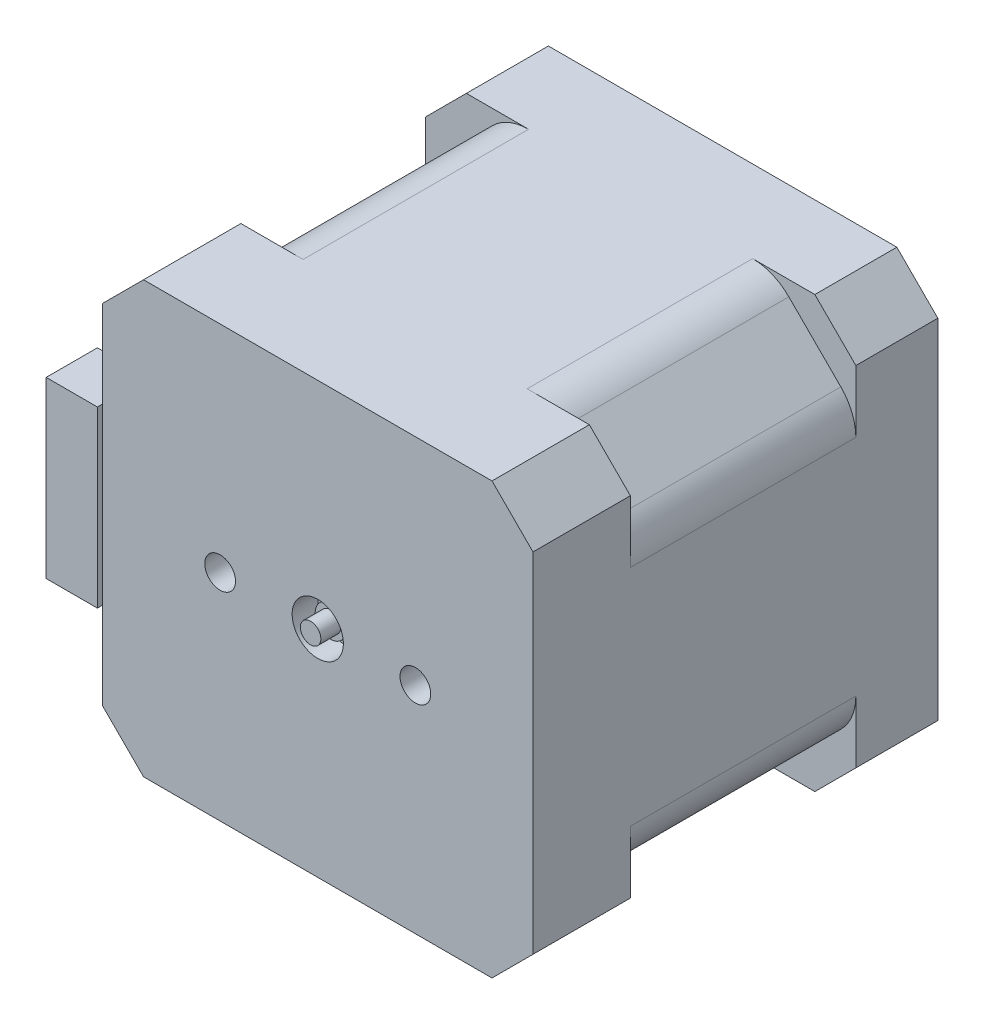
from build123d import *

# Parameters (mm, degrees)
EXTRUDE_1_DEPTH          = 8
CUT_EXTRUDE_1_REACH      = 61.933
SKETCH_2_R               = 1.5
EXTRUDE_2_DEPTH          = 22
CUT_EXTRUDE_2_DEPTH      = 22
EXTRUDE_3_DEPTH          = 9.5
SKETCH_8_R               = 1.5
CUT_EXTRUDE_3_DEPTH      = 5
SKETCH_10_R              = 2.5
CUT_EXTRUDE_4_DEPTH      = 2.5
SKETCH_11_R              = 1.5
EXTRUDE_4_DEPTH          = 1.25
SKETCH_12_R              = 1
EXTRUDE_5_DEPTH          = 1.95
FILLET_3_R               = 5
SKETCH_13_R              = 12.5
EXTRUDE_6_DEPTH          = 2
SKETCH_14_R              = 2.5
EXTRUDE_7_DEPTH          = 11
CUT_EXTRUDE_5_DEPTH      = 80.738572849
CUT_EXTRUDE_5_DEPTH_BACK = 9.8
EXTRUDE_6_2_DEPTH        = 5
EXTRUDE_8_REACH          = 61.412
SKETCH_18_W              = 1
SKETCH_18_H              = 1


with BuildPart() as part:
    # 草图1 → 凸台-拉伸1 (new body)
    with BuildSketch(Plane.XY):
        Polygon((0, 38), (4, 42), (38, 42), (42, 38), (42, 4), (38, 0), (4, 0), (0, 4), align=None)
    extrude(amount=-EXTRUDE_1_DEPTH)

    # 草图2 → 切除-拉伸1 (cut, up to next)
    with BuildSketch(Plane.XY, mode=Mode.PRIVATE) as cut_extrude_1_sk1:
        with Locations((5.5, 36.5)):
            Circle(SKETCH_2_R)
    cut_extrude_1_tool1 = extrude(cut_extrude_1_sk1.sketch, amount=-CUT_EXTRUDE_1_REACH, mode=Mode.PRIVATE) & part.part
    # 草图2 → 切除-拉伸1 (cut, up to next)
    with BuildSketch(Plane.XY, mode=Mode.PRIVATE) as cut_extrude_1_sk2:
        with Locations(Location((5.5, 5.5, 0), (0, 0, 180))):
            Circle(SKETCH_2_R)
    cut_extrude_1_tool2 = extrude(cut_extrude_1_sk2.sketch, amount=-CUT_EXTRUDE_1_REACH, mode=Mode.PRIVATE) & part.part
    # 草图2 → 切除-拉伸1 (cut, up to next)
    with BuildSketch(Plane.XY, mode=Mode.PRIVATE) as cut_extrude_1_sk3:
        with Locations(Location((36.5, 36.5, 0), (0, 0, 180))):
            Circle(SKETCH_2_R)
    cut_extrude_1_tool3 = extrude(cut_extrude_1_sk3.sketch, amount=-CUT_EXTRUDE_1_REACH, mode=Mode.PRIVATE) & part.part
    # 草图2 → 切除-拉伸1 (cut, up to next)
    with BuildSketch(Plane.XY, mode=Mode.PRIVATE) as cut_extrude_1_sk4:
        with Locations((36.5, 5.5)):
            Circle(SKETCH_2_R)
    cut_extrude_1_tool4 = extrude(cut_extrude_1_sk4.sketch, amount=-CUT_EXTRUDE_1_REACH, mode=Mode.PRIVATE) & part.part
    add(cut_extrude_1_tool1.solids().sort_by_distance((5.5, 36.5, 0))[0], mode=Mode.SUBTRACT)
    add(cut_extrude_1_tool2.solids().sort_by_distance((5.5, 5.5, 0))[0], mode=Mode.SUBTRACT)
    add(cut_extrude_1_tool3.solids().sort_by_distance((36.5, 36.5, 0))[0], mode=Mode.SUBTRACT)
    add(cut_extrude_1_tool4.solids().sort_by_distance((36.5, 5.5, 0))[0], mode=Mode.SUBTRACT)

    # 草图5 → 凸台-拉伸2 (add)
    with BuildSketch(Plane.XY):
        Polygon((0, 4), (4, 0), (38, 0), (42, 4), (42, 38), (38, 42), (4, 42), (0, 38), align=None)
    extrude(amount=EXTRUDE_2_DEPTH)

    # 草图6 → 切除-拉伸2 (cut)
    with BuildSketch(Plane.XY.offset(22)):
        Polygon((8, 0), (0, 8), (0, 4), (4, 0), align=None)
        Polygon((42, 8), (34, 0), (38, 0), (42, 4), align=None)
        Polygon((38, 42), (34, 42), (42, 34), (42, 38), align=None)
        Polygon((0, 38), (0, 34), (8, 42), (4, 42), align=None)
    extrude(amount=-CUT_EXTRUDE_2_DEPTH, mode=Mode.SUBTRACT)

    # 草图7 → 凸台-拉伸3 (add)
    with BuildSketch(Plane.XY.offset(22)):
        Polygon((0, 38), (0, 4), (4, 0), (38, 0), (42, 4), (42, 38), (38, 42), (4, 42), align=None)
    extrude(amount=EXTRUDE_3_DEPTH)

    # 草图8 → 切除-拉伸3 (cut)
    with BuildSketch(Plane.XY.offset(31.5)):
        with Locations((11.475, 21)):
            Circle(SKETCH_8_R)
        with Locations(Location((30.525, 21, 0), (0, 0, 180))):
            Circle(SKETCH_8_R)
    extrude(amount=-CUT_EXTRUDE_3_DEPTH, mode=Mode.SUBTRACT)

    # 草图10 → 切除-拉伸4 (cut)
    with BuildSketch(Plane.XY.offset(31.5)):
        with Locations((21, 21)):
            Circle(SKETCH_10_R)
    extrude(amount=-CUT_EXTRUDE_4_DEPTH, mode=Mode.SUBTRACT)

    # 草图11 → 凸台-拉伸4 (add)
    with BuildSketch(Plane.XY.offset(29)):
        with Locations((21, 21)):
            Circle(SKETCH_11_R)
    extrude(amount=EXTRUDE_4_DEPTH)

    # 草图12 → 凸台-拉伸5 (add)
    with BuildSketch(Plane.XY.offset(30.25)):
        with Locations((21, 21)):
            Circle(SKETCH_12_R)
    extrude(amount=EXTRUDE_5_DEPTH)

    # 圆角3
    fillet_3_edges = [part.edges().sort_by_distance(p)[0] for p in [
        (42, 8, 11),
        (34, 0, 11),
        (0, 8, 11),
        (8, 0, 11),
        (0, 34, 11),
        (8, 42, 11),
        (42, 34, 11),
        (34, 42, 11),
    ]]
    fillet(fillet_3_edges, radius=FILLET_3_R)

    # 草图13 → Extrude 6 (add)
    with BuildSketch(Plane(origin=(0, 0, -8), x_dir=(-1, 0, 0), z_dir=(0, 0, -1))):
        with Locations((-21, 21)):
            Circle(SKETCH_13_R)
    extrude(amount=EXTRUDE_6_DEPTH)

    # 草图14 → 凸台-拉伸7 (add)
    with BuildSketch(Plane(origin=(0, 0, -10), x_dir=(-1, 0, 0), z_dir=(0, 0, -1))):
        with Locations(Location((-21, 21, 0), (0, 0, 180))):
            Circle(SKETCH_14_R)
    extrude(amount=EXTRUDE_7_DEPTH)

    # 草图16 → 切除-拉伸5 (cut, two sides: drawn at the far end of the back side and taken through both)
    with BuildSketch(Plane(origin=(0, 0, -21), x_dir=(-1, 0, 0), z_dir=(0, 0, -1)).offset(-CUT_EXTRUDE_5_DEPTH_BACK)):
        Polygon((-96.850602173, 23), (-22.5, 23), (-19.5, 23), (54.850602173, 23), (54.850602173, 171.701204346), (-96.850602173, 171.701204346), align=None)
    extrude(amount=CUT_EXTRUDE_5_DEPTH + CUT_EXTRUDE_5_DEPTH_BACK, mode=Mode.SUBTRACT)

    # 草图17 → Extrude 6 2 (add)
    with BuildSketch(Plane.ZY):
        Polygon((27, 15), (27, 12.5), (32, 12.5), (32, 29.5), (27, 29.5), (27, 27), (28, 27), (28, 28.5), (31, 28.5), (31, 13.5), (28, 13.5), (28, 15), align=None)
    extrude(amount=EXTRUDE_6_2_DEPTH)

    # 草图18 → 凸台-拉伸8 (add, up to next)
    with BuildSketch(Plane(origin=(0, 15, 0), x_dir=(1, 0, 0), z_dir=(0, 1, 0)), mode=Mode.PRIVATE) as extrude_8_sk1:
        with Locations((-0.5, -27.5)):
            Rectangle(SKETCH_18_W, SKETCH_18_H)
    extrude_8_tool1 = extrude(extrude_8_sk1.sketch, amount=EXTRUDE_8_REACH, mode=Mode.PRIVATE) - part.part
    add(extrude_8_tool1.solids().sort_by_distance((-0.5, 15, 27.5))[0])


solid = part.part
